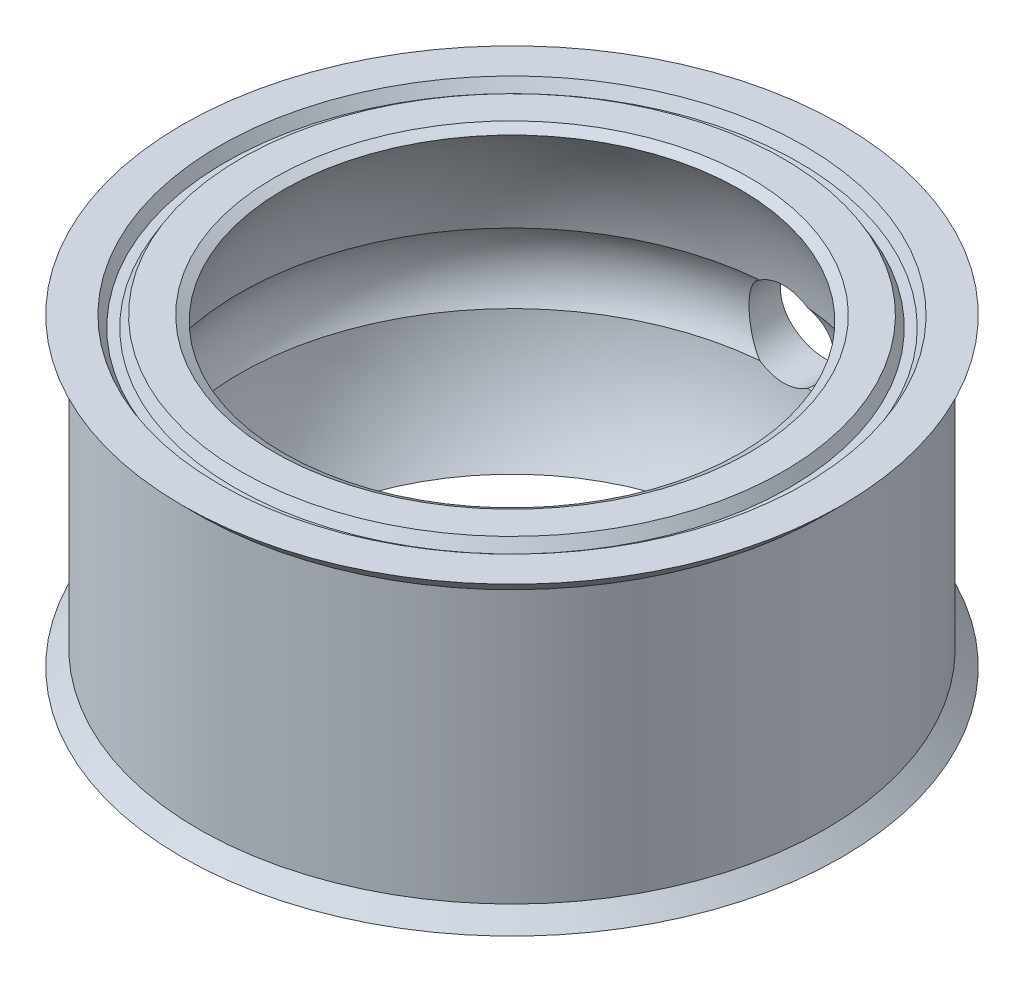
from build123d import *

# Parameters (mm, degrees)
M1_6_CLEARANCE_HOLE1_REACH  = 19.298
M1_6_CLEARANCE_HOLE1_BORE_R = 0.9906


with BuildPart() as part:
    # Sketch1 → Revolve1 (revolve)
    with BuildSketch(Plane.XY.offset(39.6748)):
        with BuildLine():
            Line((5.346583358, -3.439813446), (5.569821421, -3.568700002))
            Line((5.569821421, -3.568700002), (7.7216, -3.568700002))
            Line((7.7216, -3.568700002), (7.3406, -3.187700002))
            Line((7.3406, -3.187700002), (7.3406, 3.187699998))
            Line((7.3406, 3.187699998), (7.7216, 3.568699998))
            Line((7.7216, 3.568699998), (5.569821421, 3.568699998))
            Line((5.569821421, 3.568699998), (5.346583358, 3.439813442))
            ThreePointArc((5.346583358, 3.439813442), (6.025505417, 2.191195883), (6.38819802, 0.816992461))
            add(Edge.make_bspline(
                [(6.38819802, 0.816992461), (6.479638913, 0.666309683), (6.54632523, 0.497761492), (6.582734648, 0.325305438), (6.619144066, 0.152849383), (6.626280801, -0.028271086), (6.603553858, -0.203057306), (6.580826914, -0.377843525), (6.527609455, -0.551116314), (6.448308441, -0.708526878), (6.429710698, -0.74544294), (6.409642818, -0.781654204), (6.388198021, -0.81699246)],
                knots=[0, 0, 0, 0, 0.000528773, 0.000528773, 0.000528773, 0.001057546, 0.001057546, 0.001057546, 0.001586318, 0.001586318, 0.001586318, 0.001708661, 0.001708661, 0.001708661, 0.001708661], degree=3))
            ThreePointArc((6.388198021, -0.81699246), (6.025505418, -2.191195885), (5.346583358, -3.439813446))
        make_face()
    revolve(axis=Axis((0, 3.5687, 39.6748), (0, -1, 0)))

    # M1.6 Clearance Hole1 bore (on position points) → M1.6 Clearance Hole1 (cut, up to next)
    with BuildSketch(Plane(origin=(0, 0, 32.3342), x_dir=(-1, 0, 0), z_dir=(0, 0, -1)), mode=Mode.PRIVATE) as m1_6_clearance_hole1_sk1:
        Circle(M1_6_CLEARANCE_HOLE1_BORE_R)
    m1_6_clearance_hole1_tool1 = extrude(m1_6_clearance_hole1_sk1.sketch, amount=-M1_6_CLEARANCE_HOLE1_REACH, mode=Mode.PRIVATE) & part.part
    add(m1_6_clearance_hole1_tool1.solids().sort_by_distance((0, 0, 32.3342))[0], mode=Mode.SUBTRACT)

    # Sketch3 → Cut-Revolve1 (revolve, cut)
    with BuildSketch(Plane(origin=(0, 0, 0), x_dir=(0, 0, -1), z_dir=(1, 0, 0)), mode=Mode.PRIVATE) as cut_revolve1_sk:
        Polygon((-46.5328, 3.568699998), (-46.386153032, 3.314699998), (-46.171446968, 3.314699998), (-46.0248, 3.568699998), align=None)
    cut_revolve1 = revolve(cut_revolve1_sk.sketch.rotate(Axis((0, 3.568699998, 39.6748), (0, -1, 0)), 270), axis=Axis((0, 3.568699998, 39.6748), (0, -1, 0)), mode=Mode.SUBTRACT)

    # Mirror1: Cut-Revolve1 across plane
    add(cut_revolve1.mirror(Plane.ZX), mode=Mode.SUBTRACT)


solid = part.part
